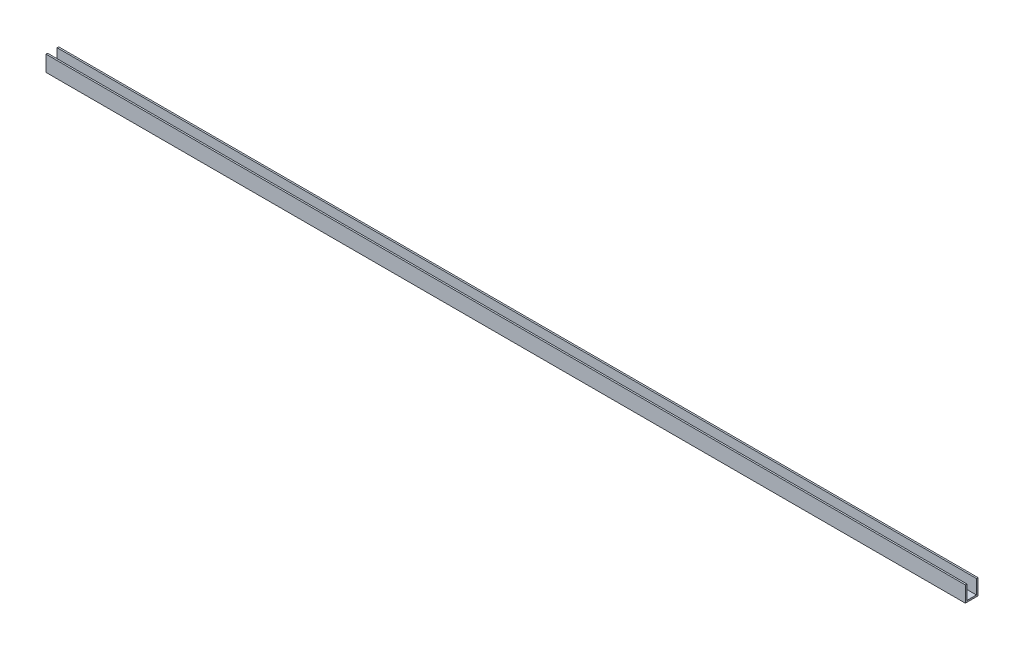
from build123d import *

# Parameters (mm, degrees)
BOSS_EXTRUDE1_DEPTH = 580


with BuildPart() as part:
    # Sketch1 → Boss-Extrude1 (new body)
    with BuildSketch(Plane(origin=(0, 0, 0), x_dir=(0, 0, -1), z_dir=(1, 0, 0))):
        Polygon((-4, 0), (4, 0), (4, 10), (3, 10), (3, 1), (-3, 1), (-3, 10), (-4, 10), align=None)
    extrude(amount=BOSS_EXTRUDE1_DEPTH)


solid = part.part
